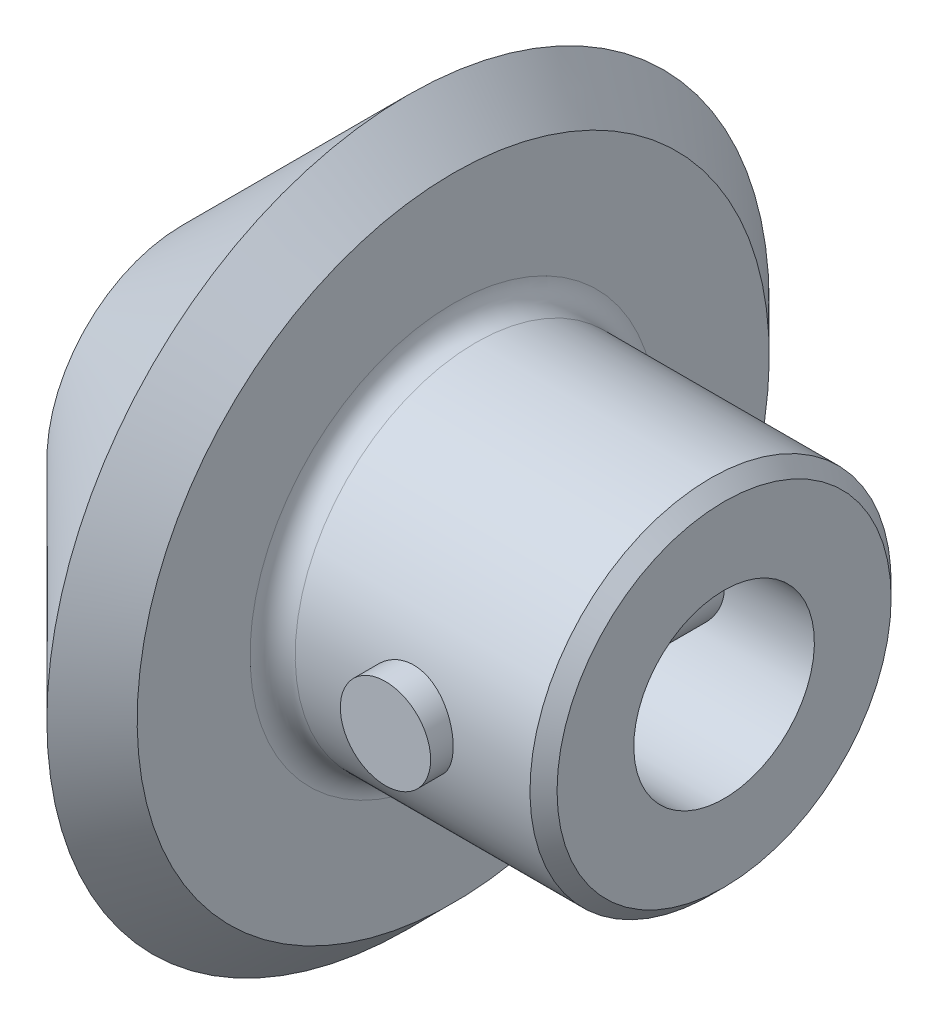
from build123d import *

# Parameters (mm, degrees)
SKETCH2_R               = 1.5
CUT_EXTRUDE1_DEPTH      = 10
SKETCH3_R               = 4
BOSS_EXTRUDE1_DEPTH     = 6
SKETCH4_R               = 2
CUT_EXTRUDE2_DEPTH      = 6
CUT_EXTRUDE3_DEPTH      = 17.492422502
CUT_EXTRUDE3_DEPTH_BACK = 17.492422502
SKETCH5_R               = 1
FILLET1_R               = 0.5
CHAMFER1_SIZE           = 0.3
SKETCH6_R               = 1
BOSS_EXTRUDE2_DEPTH     = 4.5


with BuildPart() as part:
    # Sketch1 → Revolve1 (revolve)
    with BuildSketch(Plane.XY):
        Polygon((0, 0), (0, 3), (5, 8), (6, 7), (6, 0), align=None)
    revolve(axis=Axis((6, 0, 0), (-1, 0, 0)))

    # Sketch2 → Cut-Extrude1 (cut)
    with BuildSketch(Plane.ZY):
        with Locations(Location((0, 0, 0), (0, 0, 270))):
            Circle(SKETCH2_R)
    extrude(amount=-CUT_EXTRUDE1_DEPTH, mode=Mode.SUBTRACT)

    # Sketch3 → Boss-Extrude1 (add)
    with BuildSketch(Plane(origin=(6, 0, 0), x_dir=(0, 0, -1), z_dir=(1, 0, 0))):
        with Locations(Location((0, 0, 0), (0, 0, 90))):
            Circle(SKETCH3_R)
    extrude(amount=BOSS_EXTRUDE1_DEPTH)

    # Sketch4 → Cut-Extrude2 (cut)
    with BuildSketch(Plane(origin=(12, 0, 0), x_dir=(0, 0, -1), z_dir=(1, 0, 0))):
        with Locations(Location((0, 0, 0), (0, 0, 90))):
            Circle(SKETCH4_R)
    extrude(amount=-CUT_EXTRUDE2_DEPTH, mode=Mode.SUBTRACT)

    # Sketch5 → Cut-Extrude3 (cut, two sides: drawn at the far end of the back side and taken through both)
    with BuildSketch(Plane.XY.offset(-CUT_EXTRUDE3_DEPTH_BACK)):
        with Locations((9, 0)):
            Circle(SKETCH5_R)
    extrude(amount=CUT_EXTRUDE3_DEPTH + CUT_EXTRUDE3_DEPTH_BACK, mode=Mode.SUBTRACT)

    # Fillet1
    fillet1_edges = [part.edges().sort_by_distance(p)[0] for p in [
        (6, -4, 0),
    ]]
    fillet(fillet1_edges, radius=FILLET1_R)

    # Chamfer1
    chamfer1_edges = [part.edges().sort_by_distance(p)[0] for p in [
        (12, -4, 0),
    ]]
    chamfer(chamfer1_edges, length=CHAMFER1_SIZE)


with BuildPart() as body_2:
    # Sketch6 → Boss-Extrude2 (new, symmetric)
    with BuildSketch(Plane.XY):
        with Locations((9, 0)):
            Circle(SKETCH6_R)
    extrude(amount=BOSS_EXTRUDE2_DEPTH, both=True)


solid = Compound([part.part, body_2.part])
